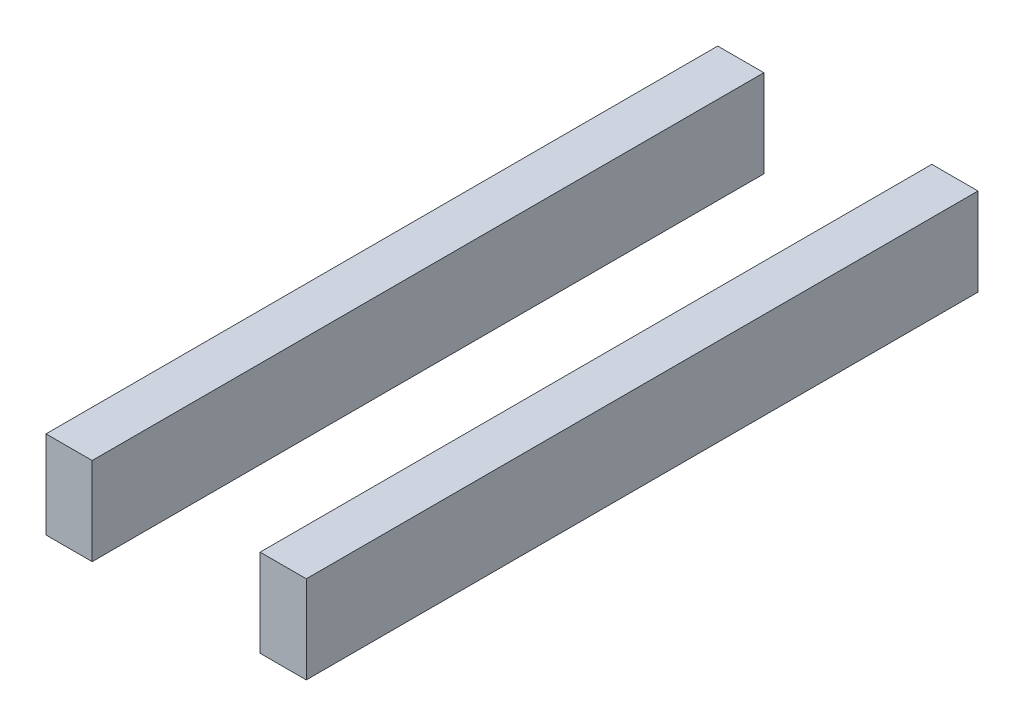
from build123d import *

# Parameters (mm, degrees)
SKETCH_1_W        = 3.161649006
SKETCH_1_H        = 45.997631422
EXTRUDE_2_DEPTH   = 6
EXTRUDE_2_2_DEPTH = 6


with BuildPart() as part:
    # Эскиз1 → Бобышка-Вытянуть2 (new body)
    with BuildSketch(Plane(origin=(0, 0, 0), x_dir=(1, 0, 0), z_dir=(0, 1, 0))):
        with Locations((6.088998872, -22.682063178)):
            Rectangle(SKETCH_1_W, SKETCH_1_H)
    extrude(amount=EXTRUDE_2_DEPTH)


with BuildPart() as body_2:
    # Эскиз1 → Extrude 2 2 (new body)
    with BuildSketch(Plane(origin=(0, 0, 0), x_dir=(1, 0, 0), z_dir=(0, 1, 0))):
        with Locations((-8.256405309, -22.998815711)):
            Rectangle(SKETCH_1_W, SKETCH_1_H)
    extrude(amount=EXTRUDE_2_2_DEPTH)


solid = Compound([part.part, body_2.part])
